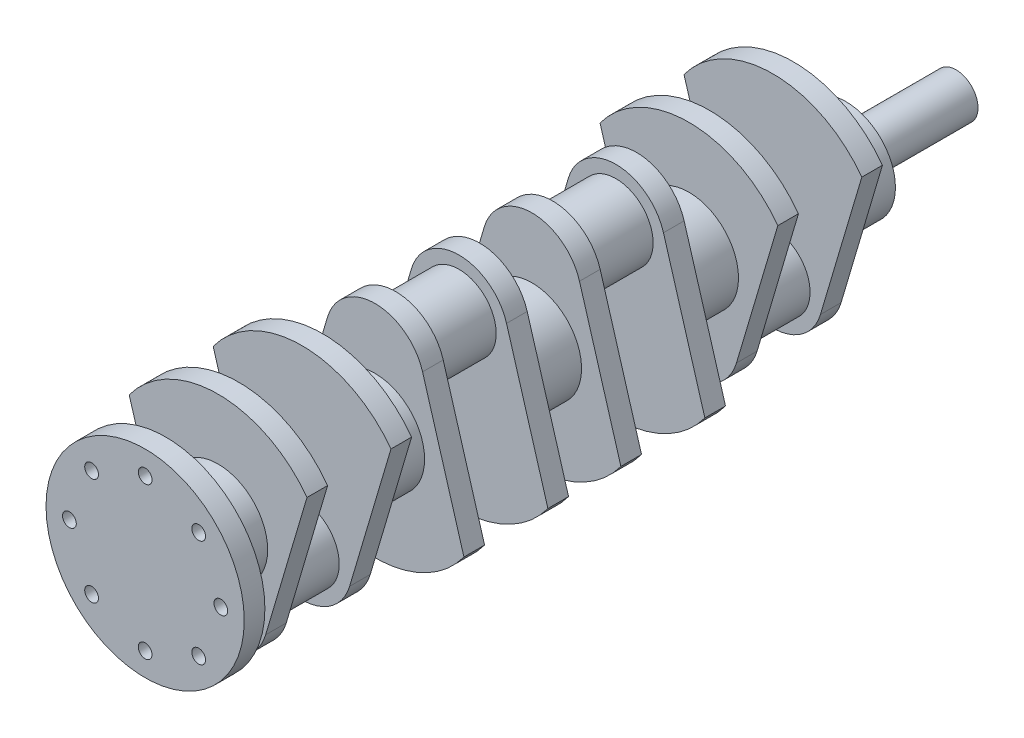
from build123d import *

# Parameters (mm, degrees)
BOSS_EXTRUDE1_DEPTH   = 15
SKETCH3_R             = 36
BOSS_EXTRUDE2_DEPTH   = 38
SKETCH4_R             = 27
BOSS_EXTRUDE3_DEPTH   = 46
BODY_MOVE_COPY3_ANGLE = 180
SKETCH5_R             = 16
BOSS_EXTRUDE4_DEPTH   = 80
SKETCH6_R             = 72
SKETCH6_R_2           = 5
BOSS_EXTRUDE5_DEPTH   = 15


with BuildPart() as part:
    # Sketch2 → Boss-Extrude1 (new body)
    with BuildSketch(Plane.XY):
        with BuildLine():
            Line((-64.569893475, 47.23059238), (-34.517510455, -54.224552409))
            ThreePointArc((-34.517510455, -54.224552409), (0, -80), (34.517510455, -54.224552409))
            Line((34.517510455, -54.224552409), (64.569893475, 47.23059238))
            ThreePointArc((64.569893475, 47.23059238), (0, 80), (-64.569893475, 47.23059238))
        make_face()
    boss_extrude1 = extrude(amount=BOSS_EXTRUDE1_DEPTH)

    # Sketch3 → Boss-Extrude2 (add)
    with BuildSketch(Plane.XY.offset(15)):
        Circle(SKETCH3_R)
    boss_extrude2 = extrude(amount=BOSS_EXTRUDE2_DEPTH)

    # Sketch4 → Boss-Extrude3 (add)
    with BuildSketch(Plane(origin=(0, 0, 0), x_dir=(-1, 0, 0), z_dir=(0, 0, -1))):
        with Locations((0, -44)):
            Circle(SKETCH4_R)
    extrude(amount=BOSS_EXTRUDE3_DEPTH)

    # Mirror2: Boss-Extrude1, Boss-Extrude2 across plane
    add(boss_extrude1.mirror(Plane(origin=(0, 0, -23), x_dir=(1, 0, 0), z_dir=(0, 0, -1))))
    add(boss_extrude2.mirror(Plane(origin=(0, 0, -23), x_dir=(1, 0, 0), z_dir=(0, 0, -1))))


with BuildPart() as body_2:
    # Mirror6: mirrored copy
    add(part.part.mirror(Plane(origin=(0, 0, -80), x_dir=(1, 0, 0), z_dir=(0, 0, -1))))


with BuildPart() as part_1:
    # Body-Move/Copy3: moved
    add(part.part.rotate(Axis((0, 0, 0), (0, 0, 1)), BODY_MOVE_COPY3_ANGLE))


with BuildPart() as body_3:
    # Mirror7: mirrored copy
    add(body_2.part.mirror(Plane.XY.offset(34)))

    # Sketch6 → Boss-Extrude5 (add)
    with BuildSketch(Plane.XY.offset(281)):
        Circle(SKETCH6_R)
        with Locations((0, 55)):
            Circle(SKETCH6_R_2, mode=Mode.SUBTRACT)
        with Locations((38.890872965, 38.890872965)):
            Circle(SKETCH6_R_2, mode=Mode.SUBTRACT)
        with Locations((55, 0)):
            Circle(SKETCH6_R_2, mode=Mode.SUBTRACT)
        with Locations((38.890872965, -38.890872965)):
            Circle(SKETCH6_R_2, mode=Mode.SUBTRACT)
        with Locations((0, -55)):
            Circle(SKETCH6_R_2, mode=Mode.SUBTRACT)
        with Locations((-38.890872965, -38.890872965)):
            Circle(SKETCH6_R_2, mode=Mode.SUBTRACT)
        with Locations((-55, 0)):
            Circle(SKETCH6_R_2, mode=Mode.SUBTRACT)
        with Locations((-38.890872965, 38.890872965)):
            Circle(SKETCH6_R_2, mode=Mode.SUBTRACT)
    extrude(amount=BOSS_EXTRUDE5_DEPTH)


with BuildPart() as body_4:
    # Mirror7 2: mirrored copy
    add(part_1.part.mirror(Plane.XY.offset(34)))


with BuildPart() as body_2_1:
    add(body_2.part)

    # Sketch5 → Boss-Extrude4 (add)
    with BuildSketch(Plane(origin=(0, 0, -213), x_dir=(-1, 0, 0), z_dir=(0, 0, -1))):
        Circle(SKETCH5_R)
    extrude(amount=BOSS_EXTRUDE4_DEPTH)


with BuildPart() as body_3_1:
    add(body_3.part)

    # Combine1: union body 4, part, body 2
    add(body_4.part)
    add(part_1.part)
    add(body_2_1.part)


solid = body_3_1.part
